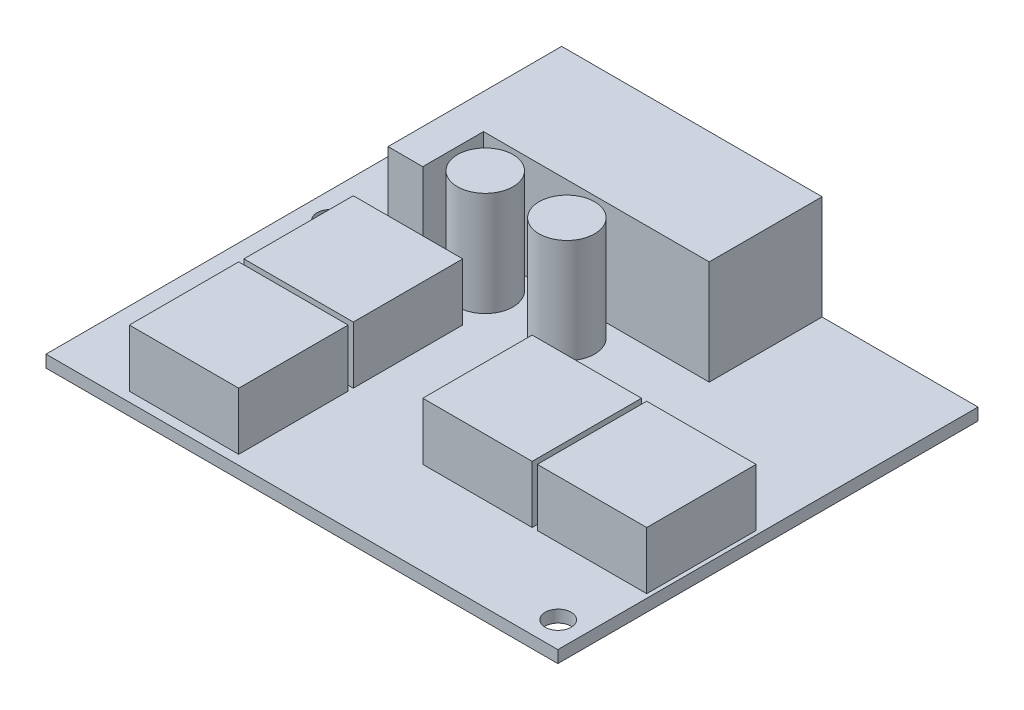
from build123d import *

# Parameters (mm, degrees)
SKETCH1_W           = 37.4396
SKETCH1_H           = 30.734
SKETCH1_R           = 0.9525
BOSS_EXTRUDE1_DEPTH = 0.889
SKETCH2_R           = 2.032
BOSS_EXTRUDE2_DEPTH = 7.62
SKETCH3_W           = 16.51
SKETCH3_H           = 8.255
SKETCH3_R           = 0.9525
BOSS_EXTRUDE4_DEPTH = 7.62
SKETCH4_W           = 8.001
SKETCH4_H           = 8.001
BOSS_EXTRUDE5_DEPTH = 4.191


with BuildPart() as part:
    # Sketch1 → Boss-Extrude1 (new body)
    with BuildSketch(Plane(origin=(0, 0, 0), x_dir=(1, 0, 0), z_dir=(0, 1, 0))):
        with Locations((18.7198, 15.367)):
            Rectangle(SKETCH1_W, SKETCH1_H)
        with Locations(Location((19.939, 28.702, 0), (0, 0, 270))):
            Circle(SKETCH1_R, mode=Mode.SUBTRACT)
        with Locations(Location((35.56, 1.905, 0), (0, 0, 270))):
            Circle(SKETCH1_R, mode=Mode.SUBTRACT)
        with Locations(Location((1.905, 18.8722, 0), (0, 0, 270))):
            Circle(SKETCH1_R, mode=Mode.SUBTRACT)
    extrude(amount=BOSS_EXTRUDE1_DEPTH)

    # Sketch2 → Boss-Extrude2 (add)
    with BuildSketch(Plane(origin=(0, 0.889, 0), x_dir=(1, 0, 0), z_dir=(0, 1, 0))):
        with Locations(Location((12.065, 20.066, 0), (0, 0, 90))):
            Circle(SKETCH2_R)
        with Locations(Location((18.034, 20.066, 0), (0, 0, 90))):
            Circle(SKETCH2_R)
    extrude(amount=BOSS_EXTRUDE2_DEPTH)

    # Sketch3 → Boss-Extrude4 (add)
    # profile 1 of 3: a face of its own
    with BuildSketch(Plane(origin=(0, 0.889, 0), x_dir=(1, 0, 0), z_dir=(0, 1, 0))):
        with Locations((17.78, 26.6065)):
            Rectangle(SKETCH3_W, SKETCH3_H)
        with Locations(Location((19.939, 28.702, 0), (0, 0, 270))):
            Circle(SKETCH3_R, mode=Mode.SUBTRACT)
    # profile 2 of 3: a face of its own
    with BuildSketch(Plane(origin=(0, 0.889, 0), x_dir=(1, 0, 0), z_dir=(0, 1, 0))):
        with Locations(Location((19.939, 28.702, 0), (0, 0, 270))):
            Circle(SKETCH3_R)
    # profile 3 of 3: a face of its own
    with BuildSketch(Plane(origin=(0, 0.889, 0), x_dir=(1, 0, 0), z_dir=(0, 1, 0))):
        Polygon((6.985, 30.734), (6.985, 18.034), (9.525, 18.034), (9.525, 22.479), (9.525, 30.734), align=None)
    extrude(amount=BOSS_EXTRUDE4_DEPTH)

    # Sketch4 → Boss-Extrude5 (add)
    with BuildSketch(Plane(origin=(0, 0.889, 0), x_dir=(1, 0, 0), z_dir=(0, 1, 0))):
        with Locations((24.765, 10.795)):
            Rectangle(SKETCH4_W, SKETCH4_H)
        with Locations((33.147, 10.795)):
            Rectangle(SKETCH4_W, SKETCH4_H)
        with Locations((9.398, 4.699)):
            Rectangle(SKETCH4_W, SKETCH4_H)
        with Locations((9.398, 13.081)):
            Rectangle(SKETCH4_W, SKETCH4_H)
    extrude(amount=BOSS_EXTRUDE5_DEPTH)


solid = part.part
